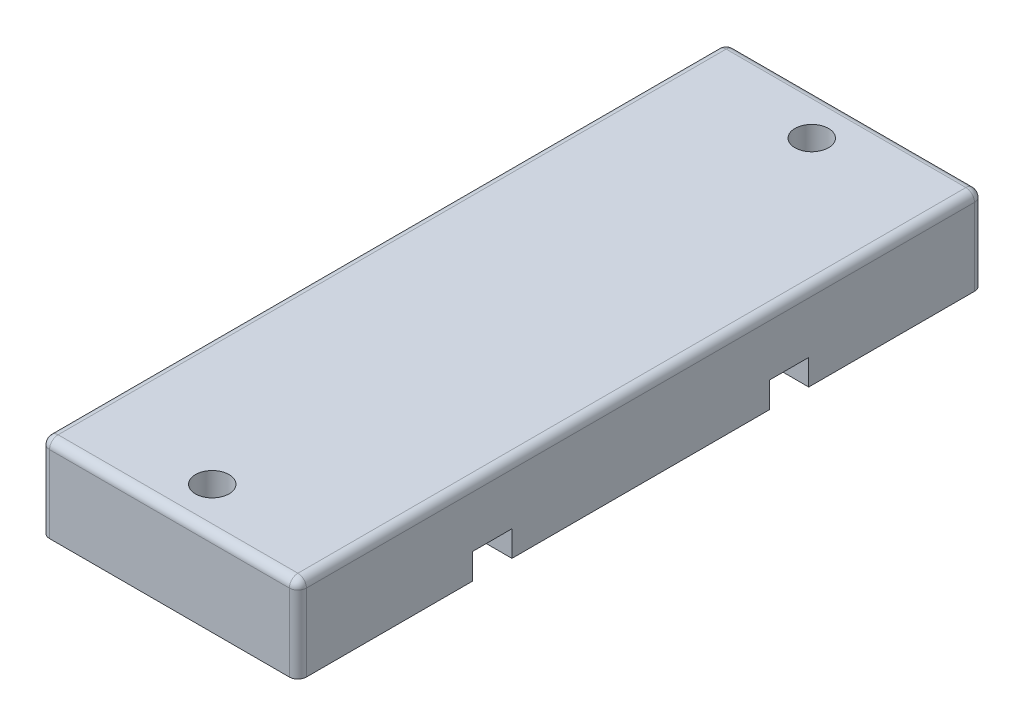
from build123d import *

# Parameters (mm, degrees)
SKETCH1_W                    = 38.1
SKETCH1_H                    = 101.6
BOSS_EXTRUDE1_DEPTH          = 12.7
SKETCH12_W                   = 5.8382662
SKETCH12_H                   = 3.81
CUT_EXTRUDE1_DEPTH           = 110.249530891
FILLET2_R                    = 1.27
F_10_0_1935_DIAMETER_HOLE2_D = 4.9784


with BuildPart() as part:
    # Sketch1 → Boss-Extrude1 (new body)
    with BuildSketch(Plane(origin=(0, 0, 0), x_dir=(1, 0, 0), z_dir=(0, 1, 0))):
        with Locations((19.05, 50.8)):
            Rectangle(SKETCH1_W, SKETCH1_H)
    extrude(amount=BOSS_EXTRUDE1_DEPTH)

    # Sketch12 → Cut-Extrude1 (cut, through all)
    with BuildSketch(Plane.ZY):
        with Locations((-72.8347159, 1.905)):
            Rectangle(SKETCH12_W, SKETCH12_H)
        with Locations((-28.8219007, 1.905)):
            Rectangle(SKETCH12_W, SKETCH12_H)
    extrude(amount=-CUT_EXTRUDE1_DEPTH, mode=Mode.SUBTRACT)

    # Fillet2
    fillet2_edges = [part.edges().sort_by_distance(p)[0] for p in [
        (19.05, 12.7, -101.6),
        (0, 12.7, -50.8),
        (19.05, 12.7, 0),
        (0, 6.35, 0),
        (0, 6.35, -101.6),
        (38.1, 6.35, -101.6),
        (38.1, 6.35, 0),
        (38.1, 12.7, -50.8),
    ]]
    fillet(fillet2_edges, radius=FILLET2_R)

    # #10 (0.1935) Diameter Hole2 (through all)
    with Locations(Plane(origin=(0, 12.7, 0), x_dir=(1, 0, 0), z_dir=(0, 1, 0))):
        with Locations((19.05, 95.25), (19.05, 6.35)):
            Hole(F_10_0_1935_DIAMETER_HOLE2_D / 2)


solid = part.part
